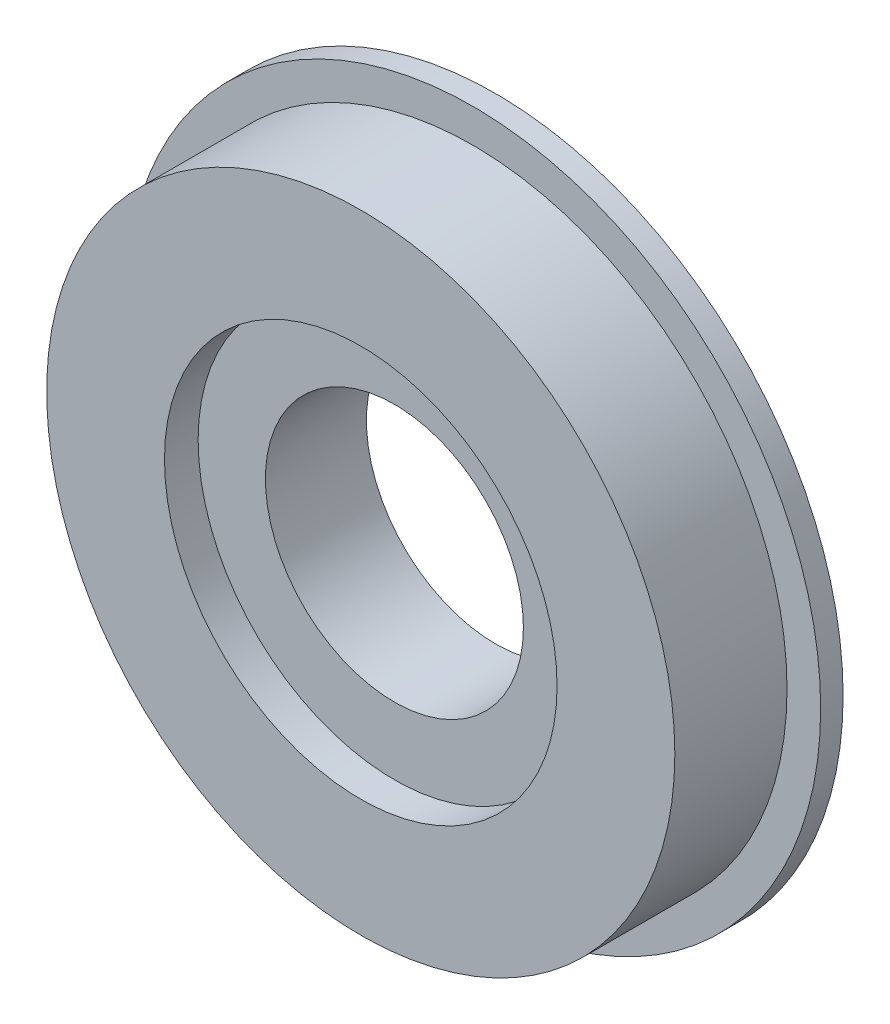
from build123d import *

# Parameters (mm, degrees)
CROQUIS1_R              = 31
SALIENTE_EXTRUIR1_DEPTH = 2
CROQUIS2_R              = 28
SALIENTE_EXTRUIR2_DEPTH = 10
CROQUIS3_R              = 11.5
CORTAR_EXTRUIR1_DEPTH   = 20
CROQUIS4_R              = 17.5
CORTAR_EXTRUIR2_DEPTH   = 3


with BuildPart() as part:
    # Croquis1 → Saliente-Extruir1 (new body)
    with BuildSketch(Plane.XY):
        Circle(CROQUIS1_R)
    extrude(amount=SALIENTE_EXTRUIR1_DEPTH)

    # Croquis2 → Saliente-Extruir2 (add)
    with BuildSketch(Plane.XY.offset(2)):
        Circle(CROQUIS2_R)
    extrude(amount=SALIENTE_EXTRUIR2_DEPTH)

    # Croquis3 → Cortar-Extruir1 (cut)
    with BuildSketch(Plane.XY.offset(12)):
        Circle(CROQUIS3_R)
    extrude(amount=-CORTAR_EXTRUIR1_DEPTH, mode=Mode.SUBTRACT)

    # Croquis4 → Cortar-Extruir2 (cut)
    with BuildSketch(Plane.XY.offset(12)):
        Circle(CROQUIS4_R)
    extrude(amount=-CORTAR_EXTRUIR2_DEPTH, mode=Mode.SUBTRACT)


solid = part.part
